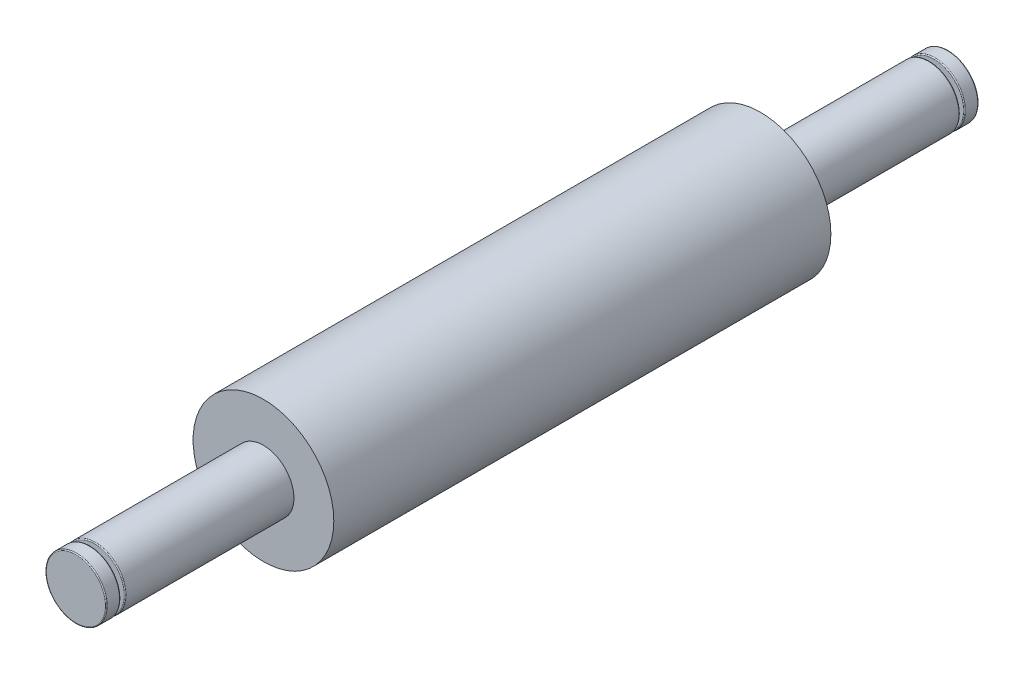
from build123d import *

# Parameters (mm, degrees)
SKETCH1_R                = 7.5
BOSS_EXTRUDE1_DEPTH      = 53
BOSS_EXTRUDE2_DEPTH      = 18
BOSS_EXTRUDE2_DEPTH_BACK = 71
SKETCH2_R                = 3.25
BOSS_EXTRUDE3_DEPTH      = 0.5
BOSS_EXTRUDE3_DEPTH_BACK = 89.5
SKETCH3_R                = 1.75
SKETCH4_R                = 3.25
BOSS_EXTRUDE4_DEPTH      = 1.5
BOSS_EXTRUDE5_START      = 1.5
SKETCH5_R                = 3.25
BOSS_EXTRUDE5_DEPTH      = 1.5
FILLET1_R                = 0.1
FILLET2_R                = 0.1


with BuildPart() as part:
    # Sketch1 → Boss-Extrude1 (new body)
    with BuildSketch(Plane.XY):
        with Locations((378.123219941, 127.240995388)):
            Circle(SKETCH1_R)
    extrude(amount=-BOSS_EXTRUDE1_DEPTH)

    # Sketch2 → Boss-Extrude2 (add, two sides: drawn at the far end of the back side and taken through both)
    with BuildSketch(Plane.XY.offset(-BOSS_EXTRUDE2_DEPTH_BACK)):
        with Locations((378.123219941, 127.240995388)):
            Circle(SKETCH2_R)
    extrude(amount=BOSS_EXTRUDE2_DEPTH + BOSS_EXTRUDE2_DEPTH_BACK)

    # Sketch3 → Boss-Extrude3 (add, two sides: drawn at the far end of the back side and taken through both)
    with BuildSketch(Plane.XY.offset(18).offset(-BOSS_EXTRUDE3_DEPTH_BACK)):
        with Locations((378.123219941, 127.240995388)):
            Circle(SKETCH3_R)
    extrude(amount=BOSS_EXTRUDE3_DEPTH + BOSS_EXTRUDE3_DEPTH_BACK)

    # Sketch4 → Boss-Extrude4 (add)
    with BuildSketch(Plane.XY.offset(18.5)):
        with Locations((378.123219941, 127.240995388)):
            Circle(SKETCH4_R)
    extrude(amount=BOSS_EXTRUDE4_DEPTH)

    # Sketch5 → Boss-Extrude5 (add)
    with BuildSketch(Plane(origin=(0, 0, -71.5), x_dir=(-1, 0, 0), z_dir=(0, 0, -1)).offset(BOSS_EXTRUDE5_START)):
        with Locations(Location((-378.123219941, 127.240995388, 0), (0, 0, 180))):
            Circle(SKETCH5_R)
    extrude(amount=-BOSS_EXTRUDE5_DEPTH)

    # Fillet1
    fillet1_edges = [part.edges().sort_by_distance(p)[0] for p in [
        (374.873219941, 127.240995388, 18.5),
        (374.873219941, 127.240995388, -71.5),
        (374.873219941, 127.240995388, -71),
        (374.873219941, 127.240995388, 18),
    ]]
    fillet(fillet1_edges, radius=FILLET1_R)

    # Fillet2
    fillet2_edges = [part.edges().sort_by_distance(p)[0] for p in [
        (374.873219941, 127.240995388, 20),
        (374.873219941, 127.240995388, -73),
    ]]
    fillet(fillet2_edges, radius=FILLET2_R)


solid = part.part
